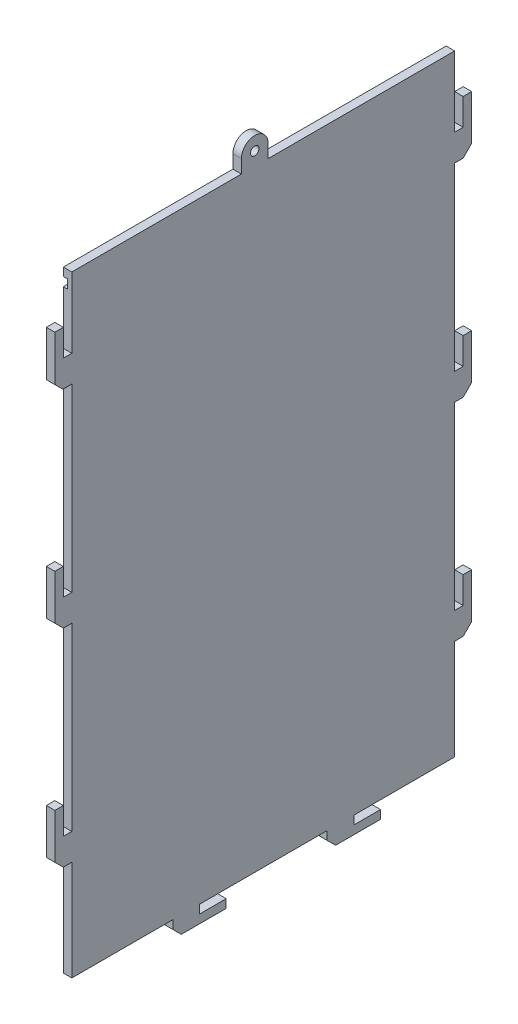
from build123d import *

# Parameters (mm, degrees)
SKETCH2_R           = 3.175
BOSS_EXTRUDE1_DEPTH = 6.35
SKETCH3_W           = 3.175
SKETCH3_H           = 6.604
CUT_EXTRUDE1_DEPTH  = 551.59524986


with BuildPart() as part:
    # Sketch2 → Boss-Extrude1 (new body)
    with BuildSketch(Plane(origin=(0, 0, 0), x_dir=(0, 0, -1), z_dir=(1, 0, 0))):
        with BuildLine():
            Line((12.003150763, 442.097734975), (138.953150763, 442.097734975))
            Line((138.953150763, 442.097734975), (138.953150763, 452.097734975))
            ThreePointArc((138.953150763, 452.097734975), (148.953150763, 462.097734975), (158.953150763, 452.097734975))
            Line((158.953150763, 452.097734975), (158.953150763, 442.097734975))
            Line((158.953150763, 442.097734975), (298.603150763, 442.097734975))
            Line((298.603150763, 442.097734975), (298.603150763, 389.397734975))
            Line((298.603150763, 389.397734975), (304.953150763, 389.397734975))
            Line((304.953150763, 389.397734975), (304.953150763, 409.397734975))
            Line((304.953150763, 409.397734975), (311.303150763, 409.397734975))
            Line((311.303150763, 409.397734975), (311.303150763, 375.747734975))
            Line((311.303150763, 375.747734975), (304.953150763, 369.397734975))
            Line((304.953150763, 369.397734975), (298.603150763, 369.397734975))
            Line((298.603150763, 369.397734975), (298.603150763, 234.397734975))
            Line((298.603150763, 234.397734975), (304.953150763, 234.397734975))
            Line((304.953150763, 234.397734975), (304.953150763, 254.397734975))
            Line((304.953150763, 254.397734975), (311.303150763, 254.397734975))
            Line((311.303150763, 254.397734975), (311.303150763, 220.747734975))
            Line((311.303150763, 220.747734975), (304.953150763, 214.397734975))
            Line((304.953150763, 214.397734975), (298.603150763, 214.397734975))
            Line((298.603150763, 214.397734975), (298.603150763, 79.397734975))
            Line((298.603150763, 79.397734975), (304.953150763, 79.397734975))
            Line((304.953150763, 79.397734975), (304.953150763, 99.397734975))
            Line((304.953150763, 99.397734975), (311.303150763, 99.397734975))
            Line((311.303150763, 99.397734975), (311.303150763, 65.747734975))
            Line((311.303150763, 65.747734975), (304.953150763, 59.397734975))
            Line((304.953150763, 59.397734975), (298.603150763, 59.397734975))
            Line((298.603150763, 59.397734975), (298.603150763, -15.602265025))
            Line((298.603150763, -15.602265025), (223.103150763, -15.602265025))
            Line((223.103150763, -15.602265025), (223.103150763, -21.952265025))
            Line((223.103150763, -21.952265025), (243.103150763, -21.952265025))
            Line((243.103150763, -21.952265025), (243.103150763, -28.302265025))
            Line((243.103150763, -28.302265025), (209.453150763, -28.302265025))
            Line((209.453150763, -28.302265025), (203.103150763, -21.952265025))
            Line((203.103150763, -21.952265025), (203.103150763, -15.602265025))
            Line((203.103150763, -15.602265025), (107.603150763, -15.602265025))
            Line((107.603150763, -15.602265025), (107.603150763, -21.952265025))
            Line((107.603150763, -21.952265025), (127.603150763, -21.952265025))
            Line((127.603150763, -21.952265025), (127.603150763, -28.302265025))
            Line((127.603150763, -28.302265025), (93.953150763, -28.302265025))
            Line((93.953150763, -28.302265025), (87.603150763, -21.952265025))
            Line((87.603150763, -21.952265025), (87.603150763, -15.602265025))
            Line((87.603150763, -15.602265025), (12.003150763, -15.602265025))
            Line((12.003150763, -15.602265025), (12.003150763, 59.397734975))
            Line((12.003150763, 59.397734975), (5.653150763, 59.397734975))
            Line((5.653150763, 59.397734975), (-0.696849237, 65.747734975))
            Line((-0.696849237, 65.747734975), (-0.696849237, 99.397734975))
            Line((-0.696849237, 99.397734975), (5.653150763, 99.397734975))
            Line((5.653150763, 99.397734975), (5.653150763, 79.397734975))
            Line((5.653150763, 79.397734975), (12.003150763, 79.397734975))
            Line((12.003150763, 79.397734975), (12.003150763, 214.366115656))
            Line((12.003150763, 214.366115656), (12.003150763, 214.397734975))
            Line((12.003150763, 214.397734975), (5.653150763, 214.397734975))
            Line((5.653150763, 214.397734975), (-0.696849237, 220.747734975))
            Line((-0.696849237, 220.747734975), (-0.696849237, 254.397734975))
            Line((-0.696849237, 254.397734975), (5.653150763, 254.397734975))
            Line((5.653150763, 254.397734975), (5.653150763, 234.397734975))
            Line((5.653150763, 234.397734975), (12.003150763, 234.397734975))
            Line((12.003150763, 234.397734975), (12.003150763, 369.397734975))
            Line((12.003150763, 369.397734975), (5.313181696, 369.397734975))
            Line((5.313181696, 369.397734975), (-0.696849237, 375.407765908))
            Line((-0.696849237, 375.407765908), (-0.696849237, 409.397734975))
            Line((-0.696849237, 409.397734975), (5.653150763, 409.397734975))
            Line((5.653150763, 409.397734975), (5.653150763, 389.397734975))
            Line((5.653150763, 389.397734975), (12.003150763, 389.397734975))
            Line((12.003150763, 389.397734975), (12.003150763, 442.097734975))
        make_face()
        with Locations((148.953150763, 452.097734975)):
            Circle(SKETCH2_R, mode=Mode.SUBTRACT)
    extrude(amount=BOSS_EXTRUDE1_DEPTH)

    # Sketch3 → Cut-Extrude1 (cut, through all)
    with BuildSketch(Plane.XY.offset(-12.003150763)):
        with Locations((1.5875, 432.699734975)):
            Rectangle(SKETCH3_W, SKETCH3_H)
    extrude(amount=-CUT_EXTRUDE1_DEPTH, mode=Mode.SUBTRACT)


solid = part.part
